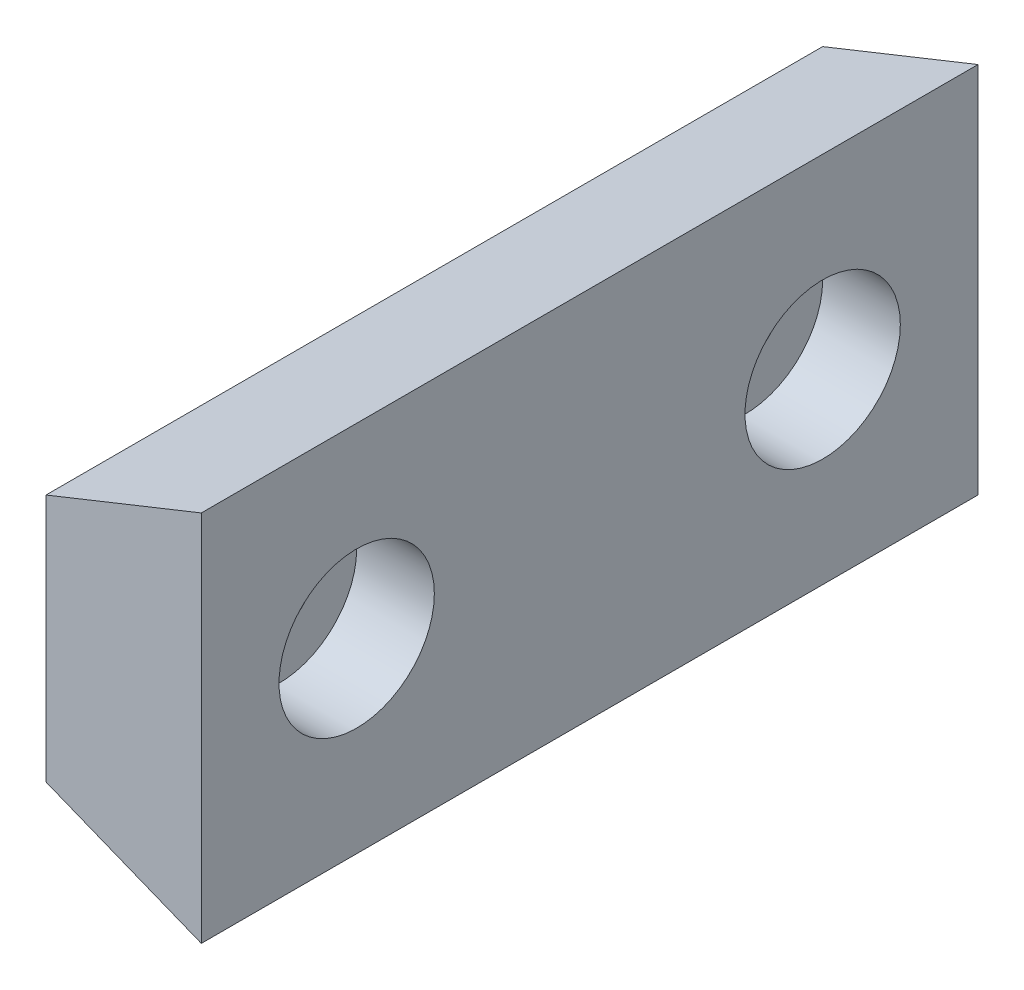
from build123d import *

# Parameters (mm, degrees)
RESSALTO_EXTRUS_O1_DEPTH = 25
ESBO_O2_R                = 1.05
CORTE_EXTRUS_O1_DEPTH    = 20
ESBO_O3_R                = 2.5
CORTE_EXTRUS_O3_DEPTH    = 2.5


with BuildPart() as part:
    # Esboço1 → Ressalto-extrusão1 (new body)
    with BuildSketch(Plane(origin=(0, 0, 0), x_dir=(0, 1, 0), z_dir=(0, 0, 1))):
        Polygon((-6, 0), (6, 0), (4, 5), (-4, 5), align=None)
    extrude(amount=RESSALTO_EXTRUS_O1_DEPTH)

    # Esboço2 → Corte-extrusão1 (cut)
    with BuildSketch(Plane.YZ):
        with Locations(Location((0, 20, 0), (0, 0, 270))):
            Circle(ESBO_O2_R)
        with Locations(Location((0, 5, 0), (0, 0, 270))):
            Circle(ESBO_O2_R)
    extrude(amount=-CORTE_EXTRUS_O1_DEPTH, mode=Mode.SUBTRACT)

    # Esboço3 → Corte-extrusão3 (cut)
    with BuildSketch(Plane.YZ):
        with Locations(Location((0, 20, 0), (0, 0, 270))):
            Circle(ESBO_O3_R)
        with Locations(Location((0, 5, 0), (0, 0, 270))):
            Circle(ESBO_O3_R)
    extrude(amount=-CORTE_EXTRUS_O3_DEPTH, mode=Mode.SUBTRACT)


solid = part.part
